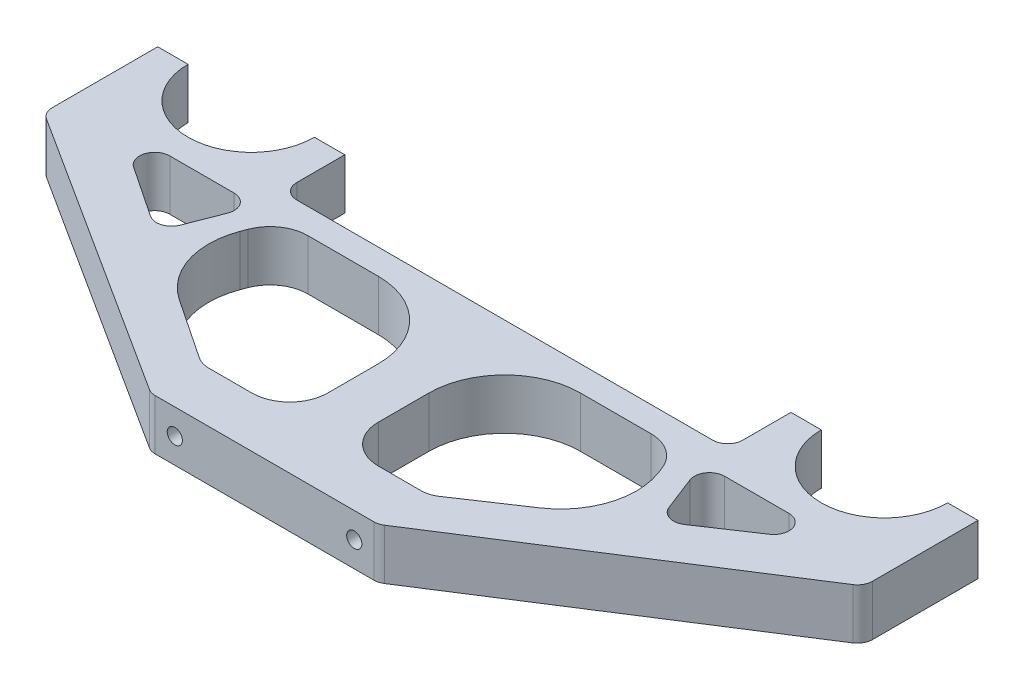
from build123d import *

# Parameters (mm, degrees)
BOSS_EXTRUDE1_DEPTH = 10
CUT_EXTRUDE5_REACH  = 103.397
SKETCH9_R           = 1.5
FILLET10_R          = 3
FILLET11_R          = 3
FILLET12_R          = 3
FILLET13_R          = 7.5
FILLET14_R          = 15
FILLET16_R          = 15
FILLET18_R          = 15
FILLET19_R          = 7.5
FILLET22_R          = 3
FILLET23_R          = 3
FILLET24_R          = 15
FILLET25_R          = 3
FILLET26_R          = 3
FILLET27_R          = 3
FILLET28_R          = 3
FILLET29_R          = 3
FILLET30_R          = 3
FILLET31_R          = 3
SKETCH11_R          = 1.5
CUT_EXTRUDE6_DEPTH  = 7.5
FILLET32_R          = 7.5
FILLET33_R          = 5
FILLET34_R          = 7.5
FILLET36_R          = 5


with BuildPart() as part:
    # Sketch1 → Boss-Extrude1 (new body)
    with BuildSketch(Plane(origin=(0, 0, 0), x_dir=(1, 0, 0), z_dir=(0, 1, 0))):
        with BuildLine():
            Line((0, -12.5), (0, -60))
            Line((0, -60), (22.5, -60))
            Line((22.5, -60), (81.125, -22.5))
            Line((81.125, -22.5), (81.125, 0))
            Line((81.125, 0), (75.125, 0))
            ThreePointArc((75.125, 0), (62.625, -12.5), (50.125, 0))
            Line((50.125, 0), (44.125, 0))
            Line((44.125, 0), (44.125, -12.5))
            Line((44.125, -12.5), (0, -12.5))
        make_face()
        Polygon((39.125, -17.5), (45.538841531, -34.595428821), (22.483333333, -50), (5, -50), (5, -17.5), align=None, mode=Mode.SUBTRACT)
        Polygon((71.125, -17.5), (49.69624181, -31.817655806), (44.125, -17.5), align=None, mode=Mode.SUBTRACT)
    boss_extrude1 = extrude(amount=BOSS_EXTRUDE1_DEPTH)

    # Mirror1: Boss-Extrude1 across plane
    add(boss_extrude1.mirror(Plane(origin=(0, 10, 0), x_dir=(0, 0, 1), z_dir=(-1, 0, 0))))

    # Sketch9 → Cut-Extrude5 (cut, up to next)
    with BuildSketch(Plane.XY.offset(60), mode=Mode.PRIVATE) as cut_extrude5_sk1:
        with Locations((-17.75, 5)):
            Circle(SKETCH9_R)
    cut_extrude5_tool1 = extrude(cut_extrude5_sk1.sketch, amount=-CUT_EXTRUDE5_REACH, mode=Mode.PRIVATE) & part.part
    cut_extrude5 = cut_extrude5_tool1.solids().sort_by_distance((-17.75, 5, 60))[0]
    add(cut_extrude5, mode=Mode.SUBTRACT)

    # Mirror2: Cut-Extrude5 across plane
    add(cut_extrude5.mirror(Plane(origin=(0, 0, 0), x_dir=(0, 0, 1), z_dir=(1, 0, 0))), mode=Mode.SUBTRACT)

    # Fillet10
    fillet10_edges = [part.edges().sort_by_distance(p)[0] for p in [
        (71.125, 5, 17.5),
    ]]
    fillet(fillet10_edges, radius=FILLET10_R)

    # Fillet11
    fillet11_edges = [part.edges().sort_by_distance(p)[0] for p in [
        (44.125, 5, 17.5),
    ]]
    fillet(fillet11_edges, radius=FILLET11_R)

    # Fillet12
    fillet12_edges = [part.edges().sort_by_distance(p)[0] for p in [
        (49.69624181, 5, 31.817655806),
    ]]
    fillet(fillet12_edges, radius=FILLET12_R)

    # Fillet13
    fillet13_edges = [part.edges().sort_by_distance(p)[0] for p in [
        (39.125, 5, 17.5),
    ]]
    fillet(fillet13_edges, radius=FILLET13_R)

    # Fillet14
    fillet14_edges = [part.edges().sort_by_distance(p)[0] for p in [
        (45.538841531, 5, 34.595428821),
    ]]
    fillet(fillet14_edges, radius=FILLET14_R)

    # Fillet16
    fillet16_edges = [part.edges().sort_by_distance(p)[0] for p in [
        (5, 5, 17.5),
    ]]
    fillet(fillet16_edges, radius=FILLET16_R)

    # Fillet18
    fillet18_edges = [part.edges().sort_by_distance(p)[0] for p in [
        (-5, 5, 17.5),
    ]]
    fillet(fillet18_edges, radius=FILLET18_R)

    # Fillet19
    fillet19_edges = [part.edges().sort_by_distance(p)[0] for p in [
        (-39.125, 5, 17.5),
    ]]
    fillet(fillet19_edges, radius=FILLET19_R)

    # Fillet22
    fillet22_edges = [part.edges().sort_by_distance(p)[0] for p in [
        (44.125, 5, 12.5),
    ]]
    fillet(fillet22_edges, radius=FILLET22_R)

    # Fillet23
    fillet23_edges = [part.edges().sort_by_distance(p)[0] for p in [
        (-44.125, 5, 12.5),
    ]]
    fillet(fillet23_edges, radius=FILLET23_R)

    # Fillet24
    fillet24_edges = [part.edges().sort_by_distance(p)[0] for p in [
        (-45.538841531, 5, 34.595428821),
    ]]
    fillet(fillet24_edges, radius=FILLET24_R)

    # Fillet25
    fillet25_edges = [part.edges().sort_by_distance(p)[0] for p in [
        (-44.125, 5, 17.5),
    ]]
    fillet(fillet25_edges, radius=FILLET25_R)

    # Fillet26
    fillet26_edges = [part.edges().sort_by_distance(p)[0] for p in [
        (-49.69624181, 5, 31.817655806),
    ]]
    fillet(fillet26_edges, radius=FILLET26_R)

    # Fillet27
    fillet27_edges = [part.edges().sort_by_distance(p)[0] for p in [
        (-71.125, 5, 17.5),
    ]]
    fillet(fillet27_edges, radius=FILLET27_R)

    # Fillet28
    fillet28_edges = [part.edges().sort_by_distance(p)[0] for p in [
        (22.5, 5, 60),
    ]]
    fillet(fillet28_edges, radius=FILLET28_R)

    # Fillet29
    fillet29_edges = [part.edges().sort_by_distance(p)[0] for p in [
        (-22.5, 5, 60),
    ]]
    fillet(fillet29_edges, radius=FILLET29_R)

    # Fillet30
    fillet30_edges = [part.edges().sort_by_distance(p)[0] for p in [
        (81.125, 5, 22.5),
    ]]
    fillet(fillet30_edges, radius=FILLET30_R)

    # Fillet31
    fillet31_edges = [part.edges().sort_by_distance(p)[0] for p in [
        (-81.125, 5, 22.5),
    ]]
    fillet(fillet31_edges, radius=FILLET31_R)

    # Sketch11 → Cut-Extrude6 (cut)
    with BuildSketch(Plane(origin=(0, 0, 0), x_dir=(-1, 0, 0), z_dir=(0, 0, -1))):
        with Locations((-78.125, 5)):
            Circle(SKETCH11_R)
        with Locations((-47.125, 5)):
            Circle(SKETCH11_R)
    cut_extrude6 = extrude(amount=-CUT_EXTRUDE6_DEPTH, mode=Mode.SUBTRACT)

    # Mirror3: Cut-Extrude6 across plane
    add(cut_extrude6.mirror(Plane(origin=(0, 0, 0), x_dir=(0, 0, 1), z_dir=(1, 0, 0))), mode=Mode.SUBTRACT)

    # Fillet32
    fillet32_edges = [part.edges().sort_by_distance(p)[0] for p in [
        (5, 5, 50),
    ]]
    fillet(fillet32_edges, radius=FILLET32_R)

    # Fillet33
    fillet33_edges = [part.edges().sort_by_distance(p)[0] for p in [
        (22.483333333, 5, 50),
    ]]
    fillet(fillet33_edges, radius=FILLET33_R)

    # Fillet34
    fillet34_edges = [part.edges().sort_by_distance(p)[0] for p in [
        (-5, 5, 50),
    ]]
    fillet(fillet34_edges, radius=FILLET34_R)

    # Fillet36
    fillet36_edges = [part.edges().sort_by_distance(p)[0] for p in [
        (-22.483333333, 5, 50),
    ]]
    fillet(fillet36_edges, radius=FILLET36_R)


solid = part.part
